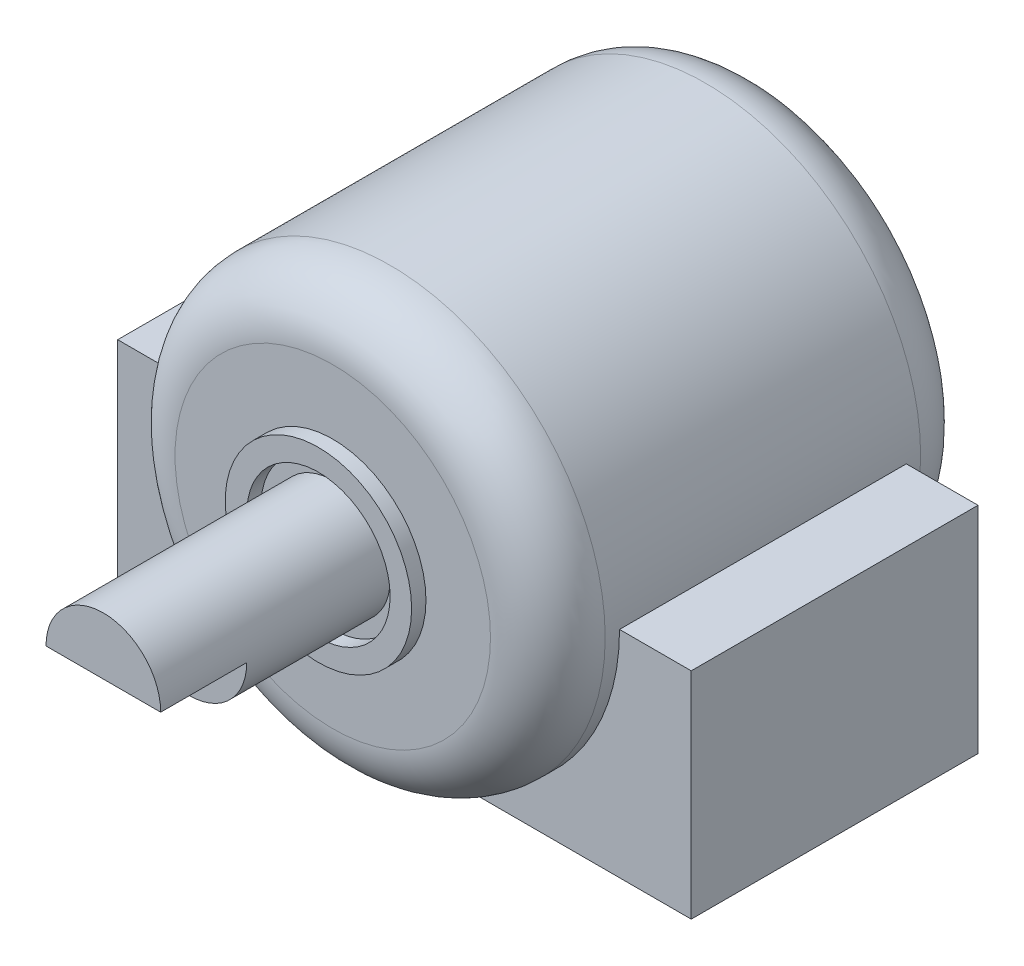
from build123d import *

# Parameters (mm, degrees)
SKETCH1_R           = 7.5
BOSS_EXTRUDE5_DEPTH = 7.5
SKETCH7_R           = 3.25
SKETCH7_R_2         = 2.5
BOSS_EXTRUDE6_DEPTH = 0.5
SKETCH8_R           = 2
BOSS_EXTRUDE7_DEPTH = 8
CUT_EXTRUDE2_START  = -3
CUT_EXTRUDE2_DEPTH  = 3
SKETCH10_W          = 20
SKETCH10_H          = 10
BOSS_EXTRUDE8_DEPTH = 7.5
FILLET2_R           = 2


with BuildPart() as part:
    # Sketch1 → Boss-Extrude5 (new, symmetric)
    with BuildSketch(Plane.XY):
        Circle(SKETCH1_R)
    extrude(amount=BOSS_EXTRUDE5_DEPTH, both=True)

    # Sketch7 → Boss-Extrude6 (add)
    with BuildSketch(Plane.XY.offset(7.5)):
        Circle(SKETCH7_R)
        Circle(SKETCH7_R_2, mode=Mode.SUBTRACT)
    extrude(amount=BOSS_EXTRUDE6_DEPTH)

    # Sketch8 → Boss-Extrude7 (add)
    with BuildSketch(Plane.XY.offset(7.5)):
        Circle(SKETCH8_R)
    extrude(amount=BOSS_EXTRUDE7_DEPTH)

    # Sketch9 → Cut-Extrude2 (cut)
    with BuildSketch(Plane.XY.offset(15.5).offset(CUT_EXTRUDE2_START)):
        with BuildLine():
            Line((-2, 0), (2, 0))
            ThreePointArc((2, 0), (0, -2), (-2, 0))
        make_face()
    extrude(amount=CUT_EXTRUDE2_DEPTH, mode=Mode.SUBTRACT)

    # Sketch10 → Boss-Extrude8 (add)
    with BuildSketch(Plane(origin=(0, 0, 0), x_dir=(1, 0, 0), z_dir=(0, 1, 0))):
        Rectangle(SKETCH10_W, SKETCH10_H)
    extrude(amount=-BOSS_EXTRUDE8_DEPTH)

    # Fillet2
    fillet2_edges = [part.edges().sort_by_distance(p)[0] for p in [
        (-7.5, 0, -7.5),
        (-7.5, 0, 7.5),
    ]]
    fillet(fillet2_edges, radius=FILLET2_R)


solid = part.part
